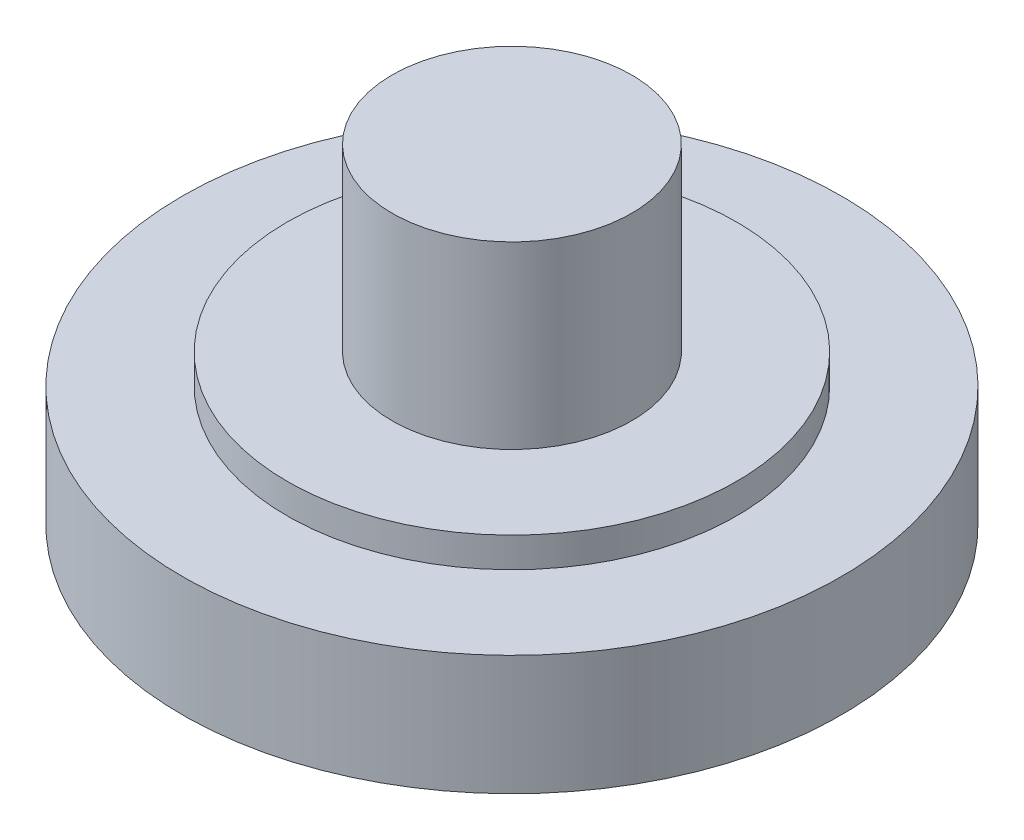
from build123d import *


with BuildPart() as part:
    # Sketch1 → Revolve1 (revolve)
    with BuildSketch(Plane.XY, mode=Mode.PRIVATE) as revolve1_sk:
        Polygon((0, 0), (5.5, 0), (5.5, 2), (3.75, 2), (3.75, 2.5), (2, 2.5), (2, 5.5), (0, 5.5), align=None)
    revolve(revolve1_sk.sketch.rotate(Axis((0, 5.5, 0), (0, -1, 0)), 180), axis=Axis((0, 5.5, 0), (0, -1, 0)))


solid = part.part
